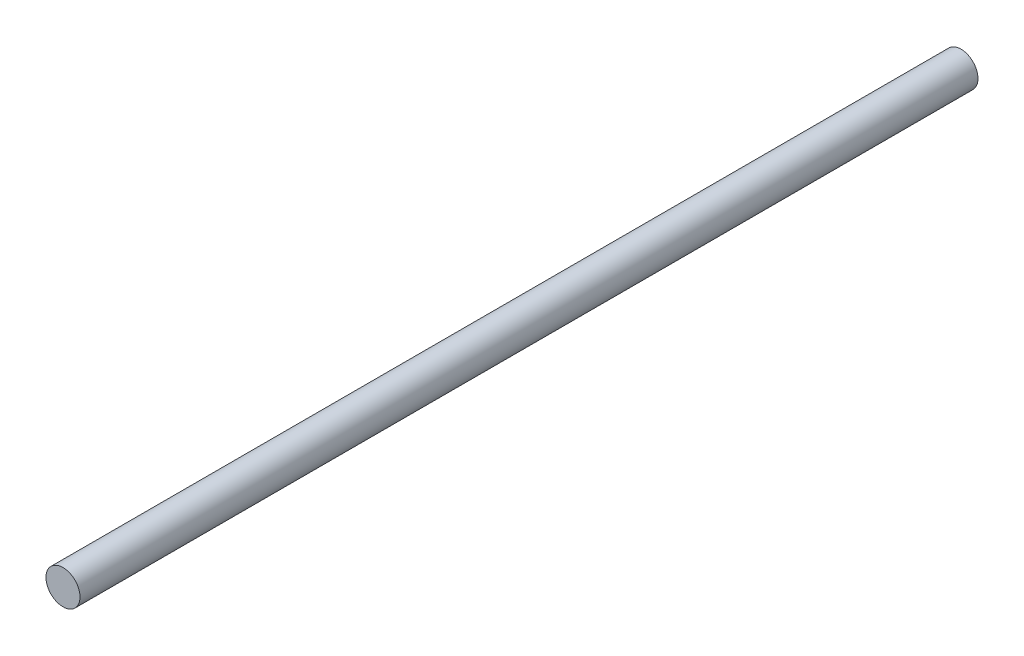
from build123d import *

# Parameters (mm, degrees)
SKETCH1_R         = 11
CROSSBARROD_DEPTH = 580


with BuildPart() as part:
    # Sketch1 → CrossbarRod (new body)
    with BuildSketch(Plane.XY):
        Circle(SKETCH1_R)
    extrude(amount=CROSSBARROD_DEPTH)


solid = part.part
